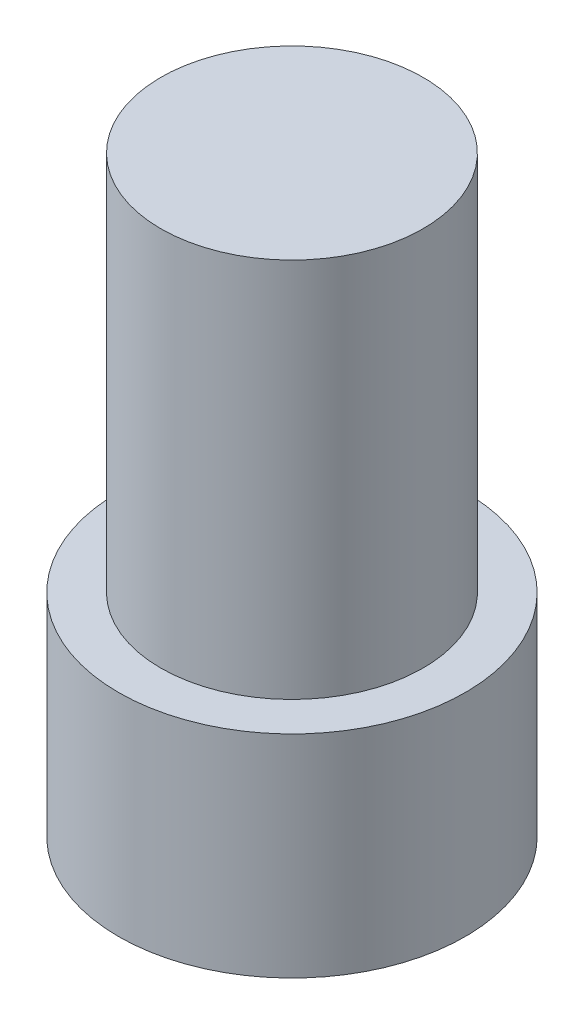
from build123d import *

# Parameters (mm, degrees)
SKETCH4_R      = 26.041670687
EXTRUDE3_DEPTH = 31.75
SKETCH6_R      = 19.698441596
EXTRUDE4_DEPTH = 57.15


with BuildPart() as part:
    # Sketch4 → Extrude3 (new body)
    with BuildSketch(Plane(origin=(0, 0, 0), x_dir=(1, 0, 0), z_dir=(0, 1, 0))):
        with Locations(Location((0, 0, 0), (0, 0, 270))):
            Circle(SKETCH4_R)
    extrude(amount=EXTRUDE3_DEPTH)

    # Sketch6 → Extrude4 (add)
    with BuildSketch(Plane(origin=(0, 31.75, 0), x_dir=(1, 0, 0), z_dir=(0, 1, 0))):
        with Locations(Location((0, 0, 0), (0, 0, 270))):
            Circle(SKETCH6_R)
    extrude(amount=EXTRUDE4_DEPTH)


solid = part.part
